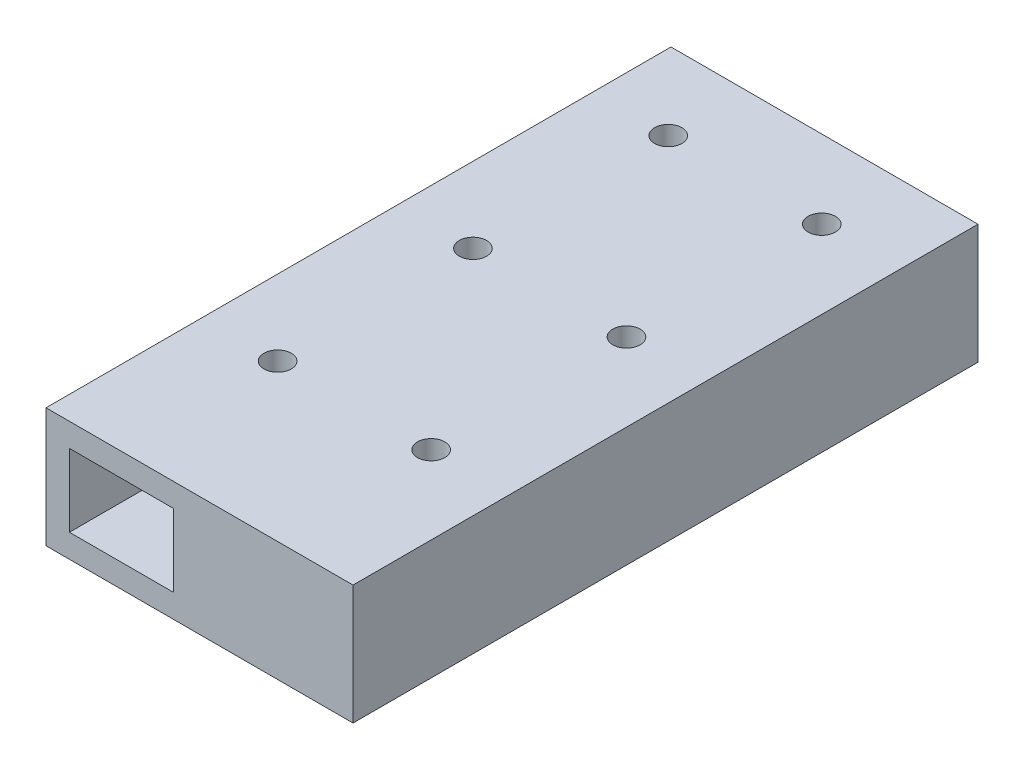
from build123d import *

# Parameters (mm, degrees)
SKETCH_2_W          = 19.3
SKETCH_2_H          = 15.3
SKETCH_2_W_2        = 13.3
SKETCH_2_H_2        = 9.3
EXTRUDE_1_DEPTH     = 80
SKETCH_3_R          = 1.75
CUT_EXTRUDE_1_DEPTH = 100
SKETCH_5_W          = 20
SKETCH_5_H          = 15.3
EXTRUDE_2_DEPTH     = 80
SKETCH_6_R          = 1.75
CUT_EXTRUDE_2_DEPTH = 100


with BuildPart() as part:
    # 草图2 → 凸台-拉伸1 (new body)
    with BuildSketch(Plane.XY):
        Rectangle(SKETCH_2_W, SKETCH_2_H)
        Rectangle(SKETCH_2_W_2, SKETCH_2_H_2, mode=Mode.SUBTRACT)
    extrude(amount=EXTRUDE_1_DEPTH)

    # 草图3 → 切除-拉伸1 (cut)
    with BuildSketch(Plane(origin=(0, 7.65, 0), x_dir=(1, 0, 0), z_dir=(0, 1, 0))):
        with Locations(Location((0, -10, 0), (0, 0, 270))):
            Circle(SKETCH_3_R)
        with Locations(Location((0, -35, 0), (0, 0, 270))):
            Circle(SKETCH_3_R)
        with Locations(Location((0, -60, 0), (0, 0, 270))):
            Circle(SKETCH_3_R)
    extrude(amount=-CUT_EXTRUDE_1_DEPTH, mode=Mode.SUBTRACT)

    # 草图5 → 凸台-拉伸2 (add)
    with BuildSketch(Plane(origin=(0, 0, 0), x_dir=(-1, 0, 0), z_dir=(0, 0, -1))):
        with Locations((-19.65, 0)):
            Rectangle(SKETCH_5_W, SKETCH_5_H)
    extrude(amount=-EXTRUDE_2_DEPTH)

    # 草图6 → 切除-拉伸2 (cut)
    with BuildSketch(Plane(origin=(0, 7.65, 0), x_dir=(1, 0, 0), z_dir=(0, 1, 0))):
        with Locations(Location((19.65, -10, 0), (0, 0, 270))):
            Circle(SKETCH_6_R)
        with Locations(Location((19.65, -35, 0), (0, 0, 270))):
            Circle(SKETCH_6_R)
        with Locations(Location((19.65, -60, 0), (0, 0, 270))):
            Circle(SKETCH_6_R)
    extrude(amount=-CUT_EXTRUDE_2_DEPTH, mode=Mode.SUBTRACT)


solid = part.part
